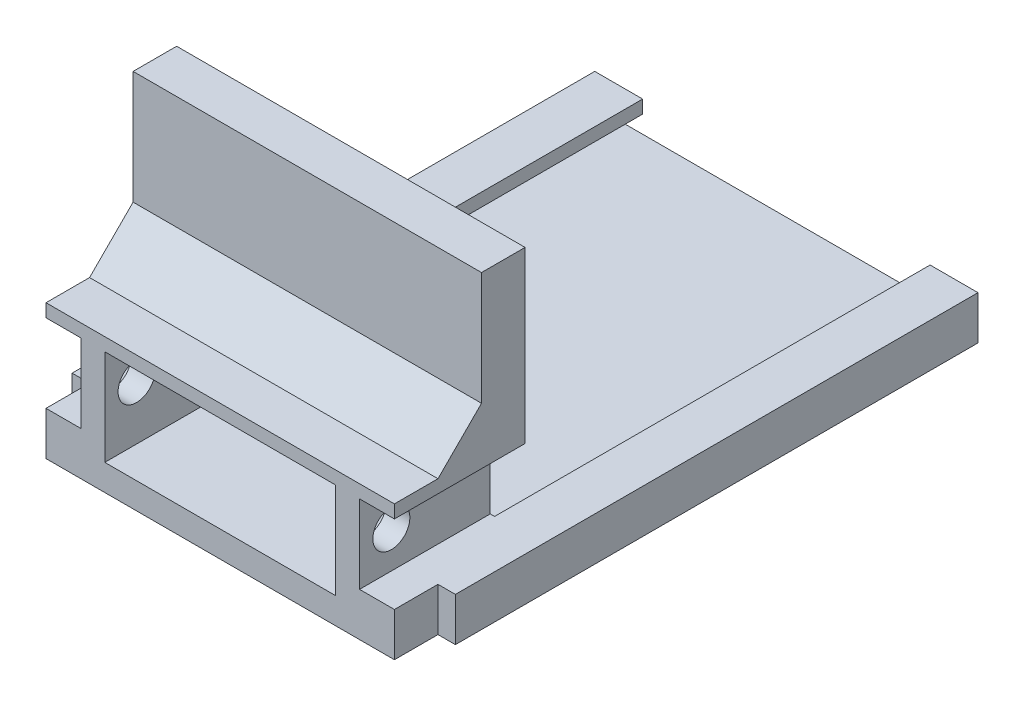
from build123d import *

# Parameters (mm, degrees)
BOSS_EXTRUDE1_DEPTH = 100
BOSS_EXTRUDE2_DEPTH = 20
SKETCH4_W           = 80
SKETCH4_H           = 31
BOSS_EXTRUDE3_DEPTH = 10
SKETCH4_2_W         = 80
SKETCH4_2_H         = 31
BOSS_EXTRUDE4_DEPTH = 20
SKETCH5_W           = 53
SKETCH5_H           = 22
SKETCH5_W_2         = 8
SKETCH5_H_2         = 18
CUT_EXTRUDE1_DEPTH  = 30
SKETCH6_W           = 10
SKETCH6_H           = 36
CUT_EXTRUDE2_DEPTH  = 80
SKETCH7_R           = 4.25
CUT_EXTRUDE3_DEPTH  = 162.012421881
CHAMFER1_SIZE       = 10


with BuildPart() as part:
    # Sketch1 → Boss-Extrude1 (new body)
    with BuildSketch(Plane.XY):
        Polygon((11, 0), (0, 0), (0, -10), (88, -10), (88, 0), (77, 0), (77, -3), (85, -3), (85, -7), (3, -7), (3, -3), (11, -3), align=None)
    extrude(amount=BOSS_EXTRUDE1_DEPTH)

    # Sketch2 → Boss-Extrude2 (add)
    with BuildSketch(Plane.XY.offset(100)):
        Polygon((77, 0), (11, 0), (11, -3), (3, -3), (3, -7), (85, -7), (85, -3), (77, -3), align=None)
        Polygon((4, 57), (4, 0), (11, 0), (77, 0), (84, 0), (84, 57), align=None)
        Polygon((0, 0), (0, -10), (88, -10), (88, 0), (84, 0), (77, 0), (77, -3), (85, -3), (85, -7), (3, -7), (3, -3), (11, -3), (11, 0), (4, 0), align=None)
    extrude(amount=BOSS_EXTRUDE2_DEPTH)

    # Sketch4 → Boss-Extrude3 (add)
    with BuildSketch(Plane.XY.offset(120)):
        with Locations((44, 5.5)):
            Rectangle(SKETCH4_W, SKETCH4_H)
    extrude(amount=BOSS_EXTRUDE3_DEPTH)

    # Sketch4<2> → Boss-Extrude4 (add)
    with BuildSketch(Plane.XY.offset(120)):
        with Locations((44, 5.5)):
            Rectangle(SKETCH4_2_W, SKETCH4_2_H)
    extrude(amount=-BOSS_EXTRUDE4_DEPTH)

    # Sketch5 → Cut-Extrude1 (cut)
    with BuildSketch(Plane.XY.offset(130)):
        with Locations((44, 7)):
            Rectangle(SKETCH5_W, SKETCH5_H)
        with Locations((8, 9)):
            Rectangle(SKETCH5_W_2, SKETCH5_H_2)
        with Locations((80, 9)):
            Rectangle(SKETCH5_W_2, SKETCH5_H_2)
    extrude(amount=-CUT_EXTRUDE1_DEPTH, mode=Mode.SUBTRACT)

    # Sketch6 → Cut-Extrude2 (cut)
    with BuildSketch(Plane.ZY.offset(-4)):
        with Locations((115, 39)):
            Rectangle(SKETCH6_W, SKETCH6_H)
    extrude(amount=-CUT_EXTRUDE2_DEPTH, mode=Mode.SUBTRACT)

    # Sketch7 → Cut-Extrude3 (cut, through all)
    with BuildSketch(Plane(origin=(76, 0, 0), x_dir=(0, 0, -1), z_dir=(1, 0, 0))):
        with Locations(Location((-122.7, 8.5, 0), (0, 0, 90))):
            Circle(SKETCH7_R)
    extrude(amount=-CUT_EXTRUDE3_DEPTH, mode=Mode.SUBTRACT)

    # Chamfer1
    chamfer1_edges = [part.edges().sort_by_distance(p)[0] for p in [
        (44, 21, 110),
    ]]
    chamfer(chamfer1_edges, length=CHAMFER1_SIZE)


solid = part.part
